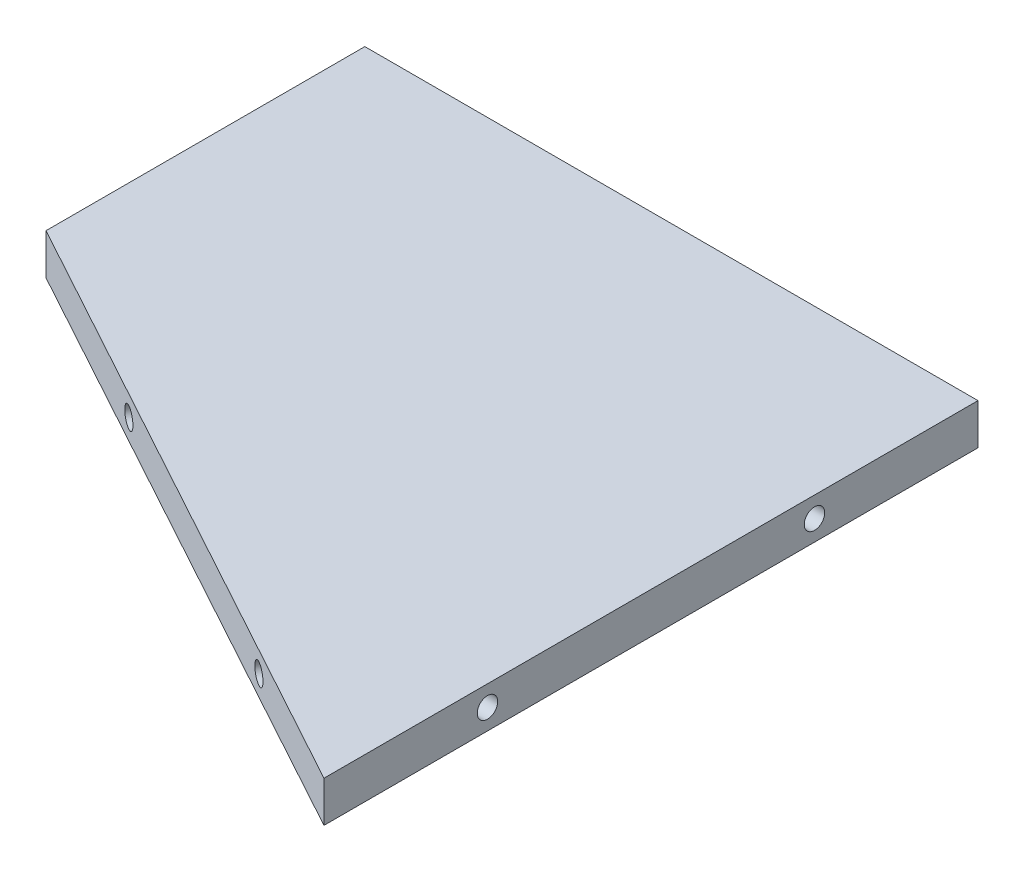
from build123d import *

# Parameters (mm, degrees)
BOSS_EXTRUDE1_DEPTH       = 5
M3X0_5_TAPPED_HOLE1_D     = 2.5
M3X0_5_TAPPED_HOLE1_DEPTH = 7.5
M3X0_5_TAPPED_HOLE1_TIP   = 0.751075774
M3X0_5_TAPPED_HOLE2_D     = 2.5
M3X0_5_TAPPED_HOLE2_DEPTH = 7.5
M3X0_5_TAPPED_HOLE2_TIP   = 0.751075774
M3X0_5_TAPPED_HOLE3_D     = 2.5
M3X0_5_TAPPED_HOLE3_DEPTH = 7.5
M3X0_5_TAPPED_HOLE3_TIP   = 0.751075774
M3X0_5_TAPPED_HOLE4_D     = 2.5
M3X0_5_TAPPED_HOLE4_DEPTH = 7.5
M3X0_5_TAPPED_HOLE4_TIP   = 0.751075774


with BuildPart() as part:
    # Sketch1 → Boss-Extrude1 (new body)
    with BuildSketch(Plane(origin=(0, 0, 0), x_dir=(1, 0, 0), z_dir=(0, 1, 0))):
        Polygon((0, -39), (75, -80), (75, 0), (0, 0), align=None)
    extrude(amount=-BOSS_EXTRUDE1_DEPTH)

    # M3x0.5 Tapped Hole1
    with Locations(Plane(origin=(0, 0, 0), x_dir=(-1, 0, 0), z_dir=(0, 0, -1))):
        with Locations((-15, -2.5), (-60, -2.5)):
            Hole(M3X0_5_TAPPED_HOLE1_D / 2, depth=M3X0_5_TAPPED_HOLE1_DEPTH)
            with Locations((0, 0, -(M3X0_5_TAPPED_HOLE1_DEPTH + M3X0_5_TAPPED_HOLE1_TIP / 2))):  # 118° drill point
                Cone(0, M3X0_5_TAPPED_HOLE1_D / 2, M3X0_5_TAPPED_HOLE1_TIP, mode=Mode.SUBTRACT)

    # M3x0.5 Tapped Hole2
    with Locations(Plane.ZY):
        with Locations((10, -2.5), (25, -2.5)):
            Hole(M3X0_5_TAPPED_HOLE2_D / 2, depth=M3X0_5_TAPPED_HOLE2_DEPTH)
            with Locations((0, 0, -(M3X0_5_TAPPED_HOLE2_DEPTH + M3X0_5_TAPPED_HOLE2_TIP / 2))):  # 118° drill point
                Cone(0, M3X0_5_TAPPED_HOLE2_D / 2, M3X0_5_TAPPED_HOLE2_TIP, mode=Mode.SUBTRACT)

    # M3x0.5 Tapped Hole3
    with Locations(Plane(origin=(75, 0, 0), x_dir=(0, 0, -1), z_dir=(1, 0, 0))):
        with Locations((-20, -2.5), (-60, -2.5)):
            Hole(M3X0_5_TAPPED_HOLE3_D / 2, depth=M3X0_5_TAPPED_HOLE3_DEPTH)
            with Locations((0, 0, -(M3X0_5_TAPPED_HOLE3_DEPTH + M3X0_5_TAPPED_HOLE3_TIP / 2))):  # 118° drill point
                Cone(0, M3X0_5_TAPPED_HOLE3_D / 2, M3X0_5_TAPPED_HOLE3_TIP, mode=Mode.SUBTRACT)

    # M3x0.5 Tapped Hole4
    with Locations(Plane(origin=(-16.414590747, 0, 30.026690391), x_dir=(0.8774480829328538, 0, 0.4796716186699602), z_dir=(-0.4796716186699602, 0, 0.8774480829328538))):
        with Locations((44.182335714, -2.5), (84.182335714, -2.5)):
            Hole(M3X0_5_TAPPED_HOLE4_D / 2, depth=M3X0_5_TAPPED_HOLE4_DEPTH)
            with Locations((0, 0, -(M3X0_5_TAPPED_HOLE4_DEPTH + M3X0_5_TAPPED_HOLE4_TIP / 2))):  # 118° drill point
                Cone(0, M3X0_5_TAPPED_HOLE4_D / 2, M3X0_5_TAPPED_HOLE4_TIP, mode=Mode.SUBTRACT)


solid = part.part
